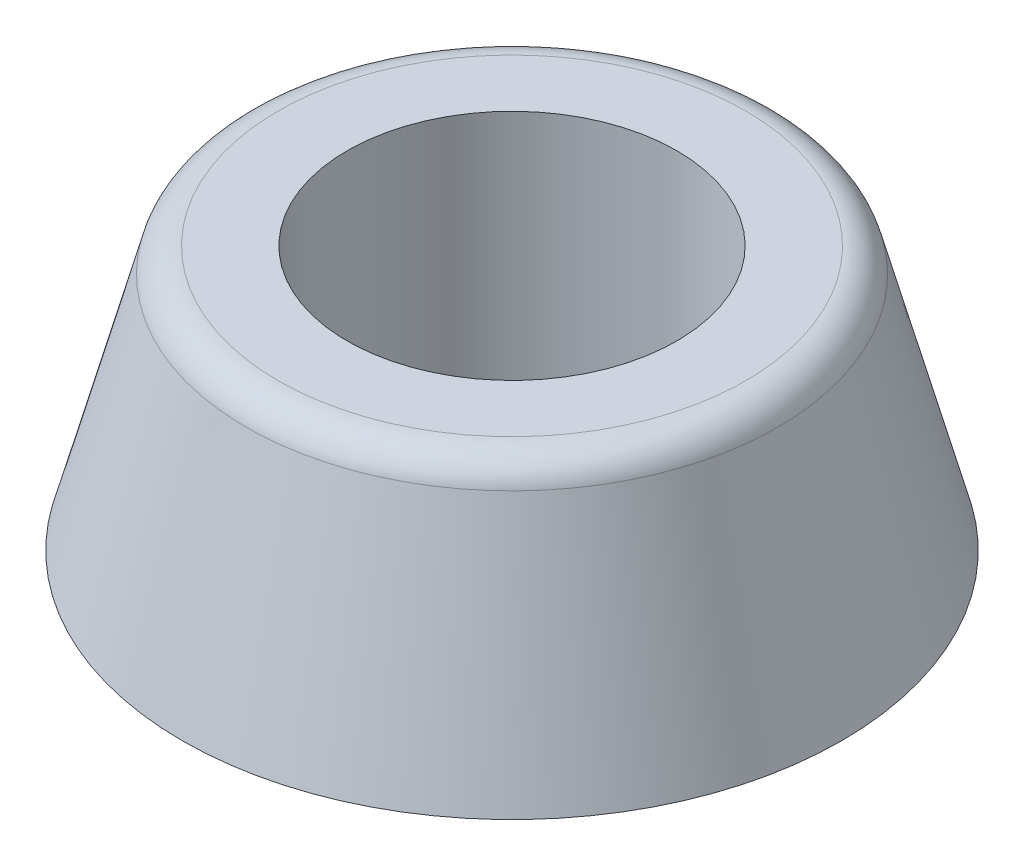
from build123d import *


with BuildPart() as part:
    # Sketch1 → Revolve1 (revolve)
    with BuildSketch(Plane.XY, mode=Mode.PRIVATE) as revolve1_sk:
        with BuildLine():
            Line((5, 4), (10, 4))
            Line((10, 4), (8.055005299, 11.258819045))
            ThreePointArc((8.055005299, 11.258819045), (7.697840902, 11.79335334), (7.089079473, 12))
            Line((7.089079473, 12), (5, 12))
            Line((5, 12), (5, 4))
        make_face()
    revolve(revolve1_sk.sketch.rotate(Axis((0, -21.86569793, 0), (0, 1, 0)), 90), axis=Axis((0, -21.86569793, 0), (0, 1, 0)))


solid = part.part
